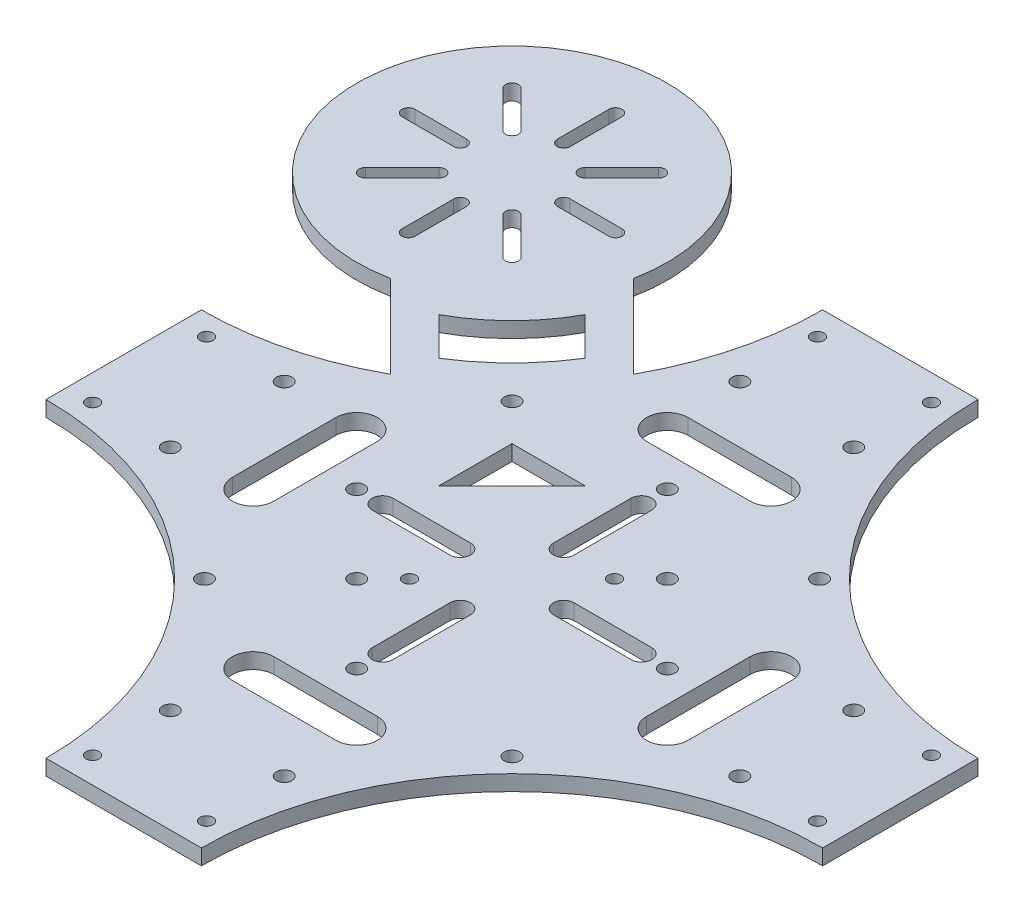
from build123d import *

# Parameters (mm, degrees)
SKETCH_1_R               = 1.25
EXTRUDE_1_DEPTH          = 3
SKETCH_2_R               = 1.5
CUT_EXTRUDE_1_DEPTH      = 3
CUT_EXTRUDE_2_DEPTH      = 3
CUT_EXTRUDE_3_DEPTH      = 3
CUT_EXTRUDE_4_DEPTH      = 10
SKETCH_6_R               = 1.5
CUT_EXTRUDE_5_DEPTH      = 10
SKETCH_7_R               = 1.5
CUT_EXTRUDE_8_DEPTH      = 10
SKETCH_8_R               = 1.5
CUT_EXTRUDE_9_DEPTH      = 10
SKETCH_9_R               = 15
CUT_EXTRUDE_10_DEPTH     = 10
SKETCH_11_R              = 1.5
EXTRUDE_3_DEPTH          = 3
CUT_EXTRUDE_12_DEPTH     = 3
EXTRUDE_4_DEPTH          = 3
SKETCH_15_R              = 15
EXTRUDE_5_DEPTH          = 3
CUT_EXTRUDE_13_DEPTH     = 3
EXTRUDE_START            = -3
EXTRUDE_7_DEPTH          = 3
CUT_EXTRUDE_14_DEPTH     = 3
CUT_EXTRUDE_15_DEPTH     = 3
PATTERN_CIRCULAR_1_COUNT = 8
SKETCH_22_R              = 1.25
CUT_EXTRUDE_17_DEPTH     = 3
SKETCH_23_R              = 1.5
CUT_EXTRUDE_18_DEPTH     = 10
SKETCH_24_R              = 1.5
CUT_EXTRUDE_19_DEPTH     = 10
CUT_EXTRUDE_20_DEPTH     = 10


with BuildPart() as part:
    # 草图1 → 凸台-拉伸1 (new body)
    # profile 1 of 4: a face of its own
    with BuildSketch(Plane(origin=(0, 0, 0), x_dir=(1, 0, 0), z_dir=(0, 1, 0))):
        with BuildLine():
            ThreePointArc((75, -15), (32.573593129, -32.573593129), (15, -75))
            Line((15, -75), (0, -75))
            Line((0, -75), (0, 0))
            Line((0, 0), (75, 0))
            Line((75, 0), (75, -15))
        make_face()
        with Locations(Location((11, -70, 0), (0, 0, 270))):
            Circle(SKETCH_1_R, mode=Mode.SUBTRACT)
        with Locations(Location((70, -11, 0), (0, 0, 270))):
            Circle(SKETCH_1_R, mode=Mode.SUBTRACT)
    # profile 2 of 4: a face of its own
    with BuildSketch(Plane(origin=(0, 0, 0), x_dir=(1, 0, 0), z_dir=(0, 1, 0))):
        with BuildLine():
            ThreePointArc((-15, -75), (-32.573593129, -32.573593129), (-75, -15))
            Line((-75, -15), (-75, 0))
            Line((-75, 0), (0, 0))
            Line((0, 0), (0, -75))
            Line((0, -75), (-15, -75))
        make_face()
        with Locations(Location((-70, -11, 0), (0, 0, 270))):
            Circle(SKETCH_1_R, mode=Mode.SUBTRACT)
        with Locations(Location((-11, -70, 0), (0, 0, 270))):
            Circle(SKETCH_1_R, mode=Mode.SUBTRACT)
    # profile 3 of 4: a face of its own
    with BuildSketch(Plane(origin=(0, 0, 0), x_dir=(1, 0, 0), z_dir=(0, 1, 0))):
        with BuildLine():
            ThreePointArc((-75, 15), (-32.573593129, 32.573593129), (-15, 75))
            Line((-15, 75), (0, 75))
            Line((0, 75), (0, 0))
            Line((0, 0), (-75, 0))
            Line((-75, 0), (-75, 15))
        make_face()
        with Locations(Location((-11, 70, 0), (0, 0, 270))):
            Circle(SKETCH_1_R, mode=Mode.SUBTRACT)
        with Locations(Location((-70, 11, 0), (0, 0, 270))):
            Circle(SKETCH_1_R, mode=Mode.SUBTRACT)
    # profile 4 of 4: a face of its own
    with BuildSketch(Plane(origin=(0, 0, 0), x_dir=(1, 0, 0), z_dir=(0, 1, 0))):
        with BuildLine():
            ThreePointArc((15, 75), (32.573593129, 32.573593129), (75, 15))
            Line((75, 15), (75, 0))
            Line((75, 0), (0, 0))
            Line((0, 0), (0, 75))
            Line((0, 75), (15, 75))
        make_face()
        with Locations(Location((70, 11, 0), (0, 0, 270))):
            Circle(SKETCH_1_R, mode=Mode.SUBTRACT)
        with Locations(Location((11, 70, 0), (0, 0, 270))):
            Circle(SKETCH_1_R, mode=Mode.SUBTRACT)
    extrude(amount=EXTRUDE_1_DEPTH)

    # 草图2 → 切除-拉伸1 (cut)
    with BuildSketch(Plane.XZ):
        with Locations(Location((0.353553391, -31.466251763, 0), (0, 0, 270))):
            Circle(SKETCH_2_R)
        with Locations(Location((31.466251763, -0.353553391, 0), (0, 0, 270))):
            Circle(SKETCH_2_R)
        with Locations(Location((-0.353553391, 31.466251763, 0), (0, 0, 90))):
            Circle(SKETCH_2_R)
        with Locations(Location((-31.466251763, 0.353553391, 0), (0, 0, 90))):
            Circle(SKETCH_2_R)
    extrude(amount=-CUT_EXTRUDE_1_DEPTH, mode=Mode.SUBTRACT)

    # 草图3 → 切除-拉伸2 (cut)
    with BuildSketch(Plane(origin=(0, 3, 0), x_dir=(1, 0, 0), z_dir=(0, 1, 0))):
        Polygon((-15.556349186, 15.556349186), (-12.02081528, 19.091883092), (-22.627416998, 22.627416998), align=None)
        Polygon((-19.091883092, 12.02081528), (-15.556349186, 15.556349186), (-22.627416998, 22.627416998), align=None)
    extrude(amount=-CUT_EXTRUDE_2_DEPTH, mode=Mode.SUBTRACT)

    # 草图4 → 切除-拉伸3 (cut)
    with BuildSketch(Plane(origin=(0, 3, 0), x_dir=(1, 0, 0), z_dir=(0, 1, 0))):
        with BuildLine():
            ThreePointArc((33.944668714, -19.80253309), (34.043922781, -8.582763971), (22.827665534, -8.285032838))
            Line((22.827665534, -8.285032838), (15.556349186, -15.556349186))
            Line((15.556349186, -15.556349186), (8.285032838, -22.827665534))
            ThreePointArc((8.285032838, -22.827665534), (8.582763971, -34.043922781), (19.80253309, -33.944668714))
            Line((19.80253309, -33.944668714), (33.944668714, -19.80253309))
        make_face()
    extrude(amount=-CUT_EXTRUDE_3_DEPTH, mode=Mode.SUBTRACT)

    # 草图5 → 切除-拉伸4 (cut)
    with BuildSketch(Plane(origin=(0, 3, 0), x_dir=(1, 0, 0), z_dir=(0, 1, 0))):
        Polygon((-22.627416998, 8.485281374), (-22.627416998, 22.627416998), (-19.091883092, 12.02081528), align=None)
        Polygon((-12.02081528, 19.091883092), (-22.627416998, 22.627416998), (-8.485281374, 22.627416998), align=None)
    extrude(amount=-CUT_EXTRUDE_4_DEPTH, mode=Mode.SUBTRACT)

    # 草图6 → 切除-拉伸5 (cut)
    with BuildSketch(Plane(origin=(0, 3, 0), x_dir=(1, 0, 0), z_dir=(0, 1, 0))):
        with Locations(Location((-35.355339059, -21.213203436, 0), (0, 0, 270))):
            Circle(SKETCH_6_R)
        with Locations(Location((-21.213203436, -35.355339059, 0), (0, 0, 270))):
            Circle(SKETCH_6_R)
        with Locations(Location((35.355339059, 21.213203436, 0), (0, 0, 270))):
            Circle(SKETCH_6_R)
        with Locations(Location((21.213203436, 35.355339059, 0), (0, 0, 270))):
            Circle(SKETCH_6_R)
    extrude(amount=-CUT_EXTRUDE_5_DEPTH, mode=Mode.SUBTRACT)

    # 草图7 → 切除-拉伸8 (cut)
    with BuildSketch(Plane(origin=(0, 3, 0), x_dir=(1, 0, 0), z_dir=(0, 1, 0))):
        with Locations(Location((-29.69848481, 29.69848481, 0), (0, 0, 270))):
            Circle(SKETCH_7_R)
        with Locations(Location((29.69848481, 29.69848481, 0), (0, 0, 270))):
            Circle(SKETCH_7_R)
        with Locations(Location((29.69848481, -29.69848481, 0), (0, 0, 270))):
            Circle(SKETCH_7_R)
        with Locations(Location((-29.69848481, -29.69848481, 0), (0, 0, 270))):
            Circle(SKETCH_7_R)
    extrude(amount=-CUT_EXTRUDE_8_DEPTH, mode=Mode.SUBTRACT)

    # 草图8 → 切除-拉伸9 (cut)
    with BuildSketch(Plane(origin=(0, 3, 0), x_dir=(1, 0, 0), z_dir=(0, 1, 0))):
        with Locations(Location((-11, 55, 0), (0, 0, 270))):
            Circle(SKETCH_8_R)
        with Locations(Location((11, 55, 0), (0, 0, 270))):
            Circle(SKETCH_8_R)
        with Locations(Location((55, 11, 0), (0, 0, 270))):
            Circle(SKETCH_8_R)
        with Locations(Location((55, -11, 0), (0, 0, 270))):
            Circle(SKETCH_8_R)
        with Locations(Location((11, -55, 0), (0, 0, 270))):
            Circle(SKETCH_8_R)
        with Locations(Location((-11, -55, 0), (0, 0, 270))):
            Circle(SKETCH_8_R)
        with Locations(Location((-55, -11, 0), (0, 0, 270))):
            Circle(SKETCH_8_R)
        with Locations(Location((-55, 11, 0), (0, 0, 270))):
            Circle(SKETCH_8_R)
    extrude(amount=-CUT_EXTRUDE_9_DEPTH, mode=Mode.SUBTRACT)

    # 草图9 → 切除-拉伸10 (cut)
    with BuildSketch(Plane(origin=(0, 3, 0), x_dir=(1, 0, 0), z_dir=(0, 1, 0))):
        with Locations(Location((0, 0, 0), (0, 0, 270))):
            Circle(SKETCH_9_R)
    extrude(amount=-CUT_EXTRUDE_10_DEPTH, mode=Mode.SUBTRACT)

    # 草图11 → 凸台-拉伸3 (add)
    with BuildSketch(Plane(origin=(0, 3, 0), x_dir=(1, 0, 0), z_dir=(0, 1, 0))):
        with Locations((-35.355339059, -21.213203436)):
            Circle(SKETCH_11_R)
        with Locations((35.355339059, 21.213203436)):
            Circle(SKETCH_11_R)
        with Locations((21.213203436, 35.355339059)):
            Circle(SKETCH_11_R)
        with Locations((0.353553391, 31.466251763)):
            Circle(SKETCH_11_R)
        with Locations((31.466251763, 0.353553391)):
            Circle(SKETCH_11_R)
        with Locations((-0.353553391, -31.466251763)):
            Circle(SKETCH_11_R)
        with Locations((-31.466251763, -0.353553391)):
            Circle(SKETCH_11_R)
        with Locations((-21.213203436, -35.355339059)):
            Circle(SKETCH_11_R)
    extrude(amount=-EXTRUDE_3_DEPTH)

    # 草图12 → 切除-拉伸12 (cut)
    with BuildSketch(Plane(origin=(0, 3, 0), x_dir=(1, 0, 0), z_dir=(0, 1, 0))):
        with BuildLine():
            Line((-44, -10), (-44, 10))
            ThreePointArc((-44, 10), (-40, 14), (-36, 10))
            Line((-36, 10), (-36, -10))
            ThreePointArc((-36, -10), (-40, -14), (-44, -10))
        make_face()
        with BuildLine():
            Line((-10, 44), (10, 44))
            ThreePointArc((10, 44), (14, 40), (10, 36))
            Line((10, 36), (-10, 36))
            ThreePointArc((-10, 36), (-14, 40), (-10, 44))
        make_face()
        with BuildLine():
            Line((44, 10), (44, -10))
            ThreePointArc((44, -10), (40, -14), (36, -10))
            Line((36, -10), (36, 10))
            ThreePointArc((36, 10), (40, 14), (44, 10))
        make_face()
        with BuildLine():
            Line((10, -44), (-10, -44))
            ThreePointArc((-10, -44), (-14, -40), (-10, -36))
            Line((-10, -36), (10, -36))
            ThreePointArc((10, -36), (14, -40), (10, -44))
        make_face()
    extrude(amount=-CUT_EXTRUDE_12_DEPTH, mode=Mode.SUBTRACT)

    # 草图14 → 凸台-拉伸4 (add)
    with BuildSketch(Plane(origin=(0, 3, 0), x_dir=(1, 0, 0), z_dir=(0, 1, 0))):
        with BuildLine():
            ThreePointArc((32.185650849, -7.152183109), (27.322232167, -6.195143755), (22.827665534, -8.285032838))
            Line((22.827665534, -8.285032838), (21.61516096, -18.569682002))
            ThreePointArc((21.61516096, -18.569682002), (27.487806659, -22.107425519), (33.944668714, -19.80253309))
            ThreePointArc((33.944668714, -19.80253309), (35.679936943, -17.205520658), (36.289282113, -14.142135624))
            ThreePointArc((36.289282113, -14.142135624), (35.187559777, -10.089382679), (32.185650849, -7.152183109))
        make_face()
        with BuildLine():
            Line((22.827665534, -8.285032838), (22.427168462, -8.685529911))
            ThreePointArc((22.427168462, -8.685529911), (20.306137435, -13.486712231), (21.61516096, -18.569682002))
            Line((21.61516096, -18.569682002), (22.827665534, -8.285032838))
        make_face()
        with BuildLine():
            Line((22.427168462, -8.685529911), (8.285032838, -22.827665534))
            ThreePointArc((8.285032838, -22.827665534), (8.582763971, -34.043922781), (19.80253309, -33.944668714))
            Line((19.80253309, -33.944668714), (21.61516096, -18.569682002))
            ThreePointArc((21.61516096, -18.569682002), (20.306137435, -13.486712231), (22.427168462, -8.685529911))
        make_face()
        with BuildLine():
            Line((21.61516096, -18.569682002), (19.80253309, -33.944668714))
            Line((19.80253309, -33.944668714), (33.944668714, -19.80253309))
            ThreePointArc((33.944668714, -19.80253309), (27.487806659, -22.107425519), (21.61516096, -18.569682002))
        make_face()
    extrude(amount=-EXTRUDE_4_DEPTH)

    # 草图15 → 凸台-拉伸5 (add)
    with BuildSketch(Plane(origin=(0, 3, 0), x_dir=(1, 0, 0), z_dir=(0, 1, 0))):
        Circle(SKETCH_15_R)
    extrude(amount=-EXTRUDE_5_DEPTH)

    # 草图17 → 切除-拉伸13 (cut)
    with BuildSketch(Plane(origin=(0, 3, 0), x_dir=(1, 0, 0), z_dir=(0, 1, 0))):
        with BuildLine():
            Line((-2, -20), (-2, -10))
            ThreePointArc((-2, -10), (0, -8), (2, -10))
            Line((2, -10), (2, -20))
            ThreePointArc((2, -20), (0, -22), (-2, -20))
        make_face()
        with BuildLine():
            Line((-20, 2), (-10, 2))
            ThreePointArc((-10, 2), (-8, 0), (-10, -2))
            Line((-10, -2), (-20, -2))
            ThreePointArc((-20, -2), (-22, 0), (-20, 2))
        make_face()
        with BuildLine():
            Line((2, 20), (2, 10))
            ThreePointArc((2, 10), (0, 8), (-2, 10))
            Line((-2, 10), (-2, 20))
            ThreePointArc((-2, 20), (0, 22), (2, 20))
        make_face()
        with BuildLine():
            Line((20, -2), (10, -2))
            ThreePointArc((10, -2), (8, 0), (10, 2))
            Line((10, 2), (20, 2))
            ThreePointArc((20, 2), (22, 0), (20, -2))
        make_face()
    extrude(amount=-CUT_EXTRUDE_13_DEPTH, mode=Mode.SUBTRACT)

    # 草图18 → 凸台-拉伸7 (add)
    with BuildSketch(Plane(origin=(0, 3, 0), x_dir=(1, 0, 0), z_dir=(0, 1, 0)).offset(EXTRUDE_START)):
        with BuildLine():
            Line((-61.977302058, 38.525223259), (-50.251262658, 50.251262658))
            Line((-50.251262658, 50.251262658), (-38.525223259, 61.977302058))
            ThreePointArc((-38.525223259, 61.977302058), (-38.078377186, 64.938218885), (-37.928932188, 67.928932188))
            ThreePointArc((-37.928932188, 67.928932188), (-91.15121571, 86.921708395), (-61.977302058, 38.525223259))
        make_face()
        with BuildLine():
            ThreePointArc((-61.977302058, 38.525223259), (-53.742560533, 41.49511182), (-46.715728753, 46.715728753))
            Line((-46.715728753, 46.715728753), (-50.251262658, 50.251262658))
            Line((-50.251262658, 50.251262658), (-61.977302058, 38.525223259))
        make_face()
        with BuildLine():
            Line((-50.251262658, 50.251262658), (-46.715728753, 46.715728753))
            ThreePointArc((-46.715728753, 46.715728753), (-41.49511182, 53.742560534), (-38.525223259, 61.977302058))
            Line((-38.525223259, 61.977302058), (-50.251262658, 50.251262658))
        make_face()
        with BuildLine():
            ThreePointArc((-45.952273324, 22.500194525), (-38.909748111, 27.067821679), (-32.573593129, 32.573593129))
            Line((-32.573593129, 32.573593129), (-46.715728753, 46.715728753))
            ThreePointArc((-46.715728753, 46.715728753), (-53.742560533, 41.49511182), (-61.977302058, 38.525223259))
            Line((-61.977302058, 38.525223259), (-45.952273324, 22.500194525))
        make_face()
        with BuildLine():
            Line((-46.715728753, 46.715728753), (-32.573593129, 32.573593129))
            ThreePointArc((-32.573593129, 32.573593129), (-27.067821679, 38.909748111), (-22.500194525, 45.952273324))
            Line((-22.500194525, 45.952273324), (-38.525223259, 61.977302058))
            ThreePointArc((-38.525223259, 61.977302058), (-41.49511182, 53.742560534), (-46.715728753, 46.715728753))
        make_face()
    extrude(amount=EXTRUDE_7_DEPTH)

    # 草图19 → 切除-拉伸14 (cut)
    with BuildSketch(Plane(origin=(0, 3, 0), x_dir=(1, 0, 0), z_dir=(0, 1, 0))):
        with BuildLine():
            ThreePointArc((-37.140781925, 51.282917549), (-39.866501787, 47.012431525), (-43.180194847, 43.180194847))
            Line((-43.180194847, 43.180194847), (-36.109127035, 36.109127035))
            ThreePointArc((-36.109127035, 36.109127035), (-32.750813989, 39.866501787), (-29.833680261, 43.975815885))
            Line((-29.833680261, 43.975815885), (-37.140781925, 51.282917549))
        make_face()
        with BuildLine():
            Line((-36.109127035, 36.109127035), (-43.180194847, 43.180194847))
            ThreePointArc((-43.180194847, 43.180194847), (-47.012431525, 39.866501787), (-51.282917549, 37.140781925))
            Line((-51.282917549, 37.140781925), (-43.975815885, 29.833680261))
            ThreePointArc((-43.975815885, 29.833680261), (-39.866501787, 32.750813989), (-36.109127035, 36.109127035))
        make_face()
    extrude(amount=-CUT_EXTRUDE_14_DEPTH, mode=Mode.SUBTRACT)

    # 草图21 → 切除-拉伸15 (cut)
    with BuildSketch(Plane(origin=(0, 3, 0), x_dir=(1, 0, 0), z_dir=(0, 1, 0))):
        with BuildLine():
            Line((-81.187184335, 82.954951288), (-74.116116524, 75.883883476))
            ThreePointArc((-74.116116524, 75.883883476), (-74.116116524, 74.116116524), (-75.883883476, 74.116116524))
            Line((-75.883883476, 74.116116524), (-82.954951288, 81.187184335))
            ThreePointArc((-82.954951288, 81.187184335), (-82.954951288, 82.954951288), (-81.187184335, 82.954951288))
        make_face()
        with BuildLine():
            Line((-59.9739809, 61.741747853), (-52.902913088, 54.670680041))
            ThreePointArc((-52.902913088, 54.670680041), (-52.902913088, 52.902913088), (-54.670680041, 52.902913088))
            Line((-54.670680041, 52.902913088), (-61.741747853, 59.9739809))
            ThreePointArc((-61.741747853, 59.9739809), (-61.741747853, 61.741747853), (-59.9739809, 61.741747853))
        make_face()
    cut_extrude_15 = extrude(amount=-CUT_EXTRUDE_15_DEPTH, mode=Mode.SUBTRACT)

    # 阵列(圆周)1: 切除-拉伸15 ×8 about axis
    pattern_circular_1_axis = Axis((-67.928932188, 0, -67.928932188), (0, 1, 0))
    for i in range(1, PATTERN_CIRCULAR_1_COUNT):
        add(cut_extrude_15.rotate(pattern_circular_1_axis, i * 360 / PATTERN_CIRCULAR_1_COUNT), mode=Mode.SUBTRACT)

    # 草图22 → 切除-拉伸17 (cut)
    with BuildSketch(Plane(origin=(0, 3, 0), x_dir=(1, 0, 0), z_dir=(0, 1, 0))):
        with Locations(Location((9.899494937, 9.899494937, 0), (0, 0, 270))):
            Circle(SKETCH_22_R)
        with Locations(Location((-9.899494937, -9.899494937, 0), (0, 0, 270))):
            Circle(SKETCH_22_R)
    extrude(amount=-CUT_EXTRUDE_17_DEPTH, mode=Mode.SUBTRACT)

    # 草图23 → 切除-拉伸18 (cut)
    with BuildSketch(Plane(origin=(0, 3, 0), x_dir=(1, 0, 0), z_dir=(0, 1, 0))):
        with Locations(Location((0, 30, 0), (0, 0, 270))):
            Circle(SKETCH_23_R)
        with Locations(Location((30, 0, 0), (0, 0, 270))):
            Circle(SKETCH_23_R)
        with Locations(Location((0, -30, 0), (0, 0, 270))):
            Circle(SKETCH_23_R)
        with Locations(Location((-30, 0, 0), (0, 0, 270))):
            Circle(SKETCH_23_R)
    extrude(amount=-CUT_EXTRUDE_18_DEPTH, mode=Mode.SUBTRACT)

    # 草图24 → 切除-拉伸19 (cut)
    with BuildSketch(Plane(origin=(0, 3, 0), x_dir=(1, 0, 0), z_dir=(0, 1, 0))):
        with Locations(Location((-15, -15, 0), (0, 0, 270))):
            Circle(SKETCH_24_R)
        with Locations(Location((15, 15, 0), (0, 0, 270))):
            Circle(SKETCH_24_R)
    extrude(amount=-CUT_EXTRUDE_19_DEPTH, mode=Mode.SUBTRACT)

    # 草图25 → 切除-拉伸20 (cut)
    with BuildSketch(Plane(origin=(0, 3, 0), x_dir=(1, 0, 0), z_dir=(0, 1, 0))):
        with BuildLine():
            Line((-2, 10), (-2, 25))
            ThreePointArc((-2, 25), (0, 27), (2, 25))
            Line((2, 25), (2, 10))
            ThreePointArc((2, 10), (0, 8), (-2, 10))
        make_face()
        with BuildLine():
            Line((10, 2), (25, 2))
            ThreePointArc((25, 2), (27, 0), (25, -2))
            Line((25, -2), (10, -2))
            ThreePointArc((10, -2), (8, 0), (10, 2))
        make_face()
        with BuildLine():
            Line((2, -10), (2, -25))
            ThreePointArc((2, -25), (0, -27), (-2, -25))
            Line((-2, -25), (-2, -10))
            ThreePointArc((-2, -10), (0, -8), (2, -10))
        make_face()
        with BuildLine():
            Line((-10, -2), (-25, -2))
            ThreePointArc((-25, -2), (-27, 0), (-25, 2))
            Line((-25, 2), (-10, 2))
            ThreePointArc((-10, 2), (-8, 0), (-10, -2))
        make_face()
    extrude(amount=-CUT_EXTRUDE_20_DEPTH, mode=Mode.SUBTRACT)


solid = part.part
